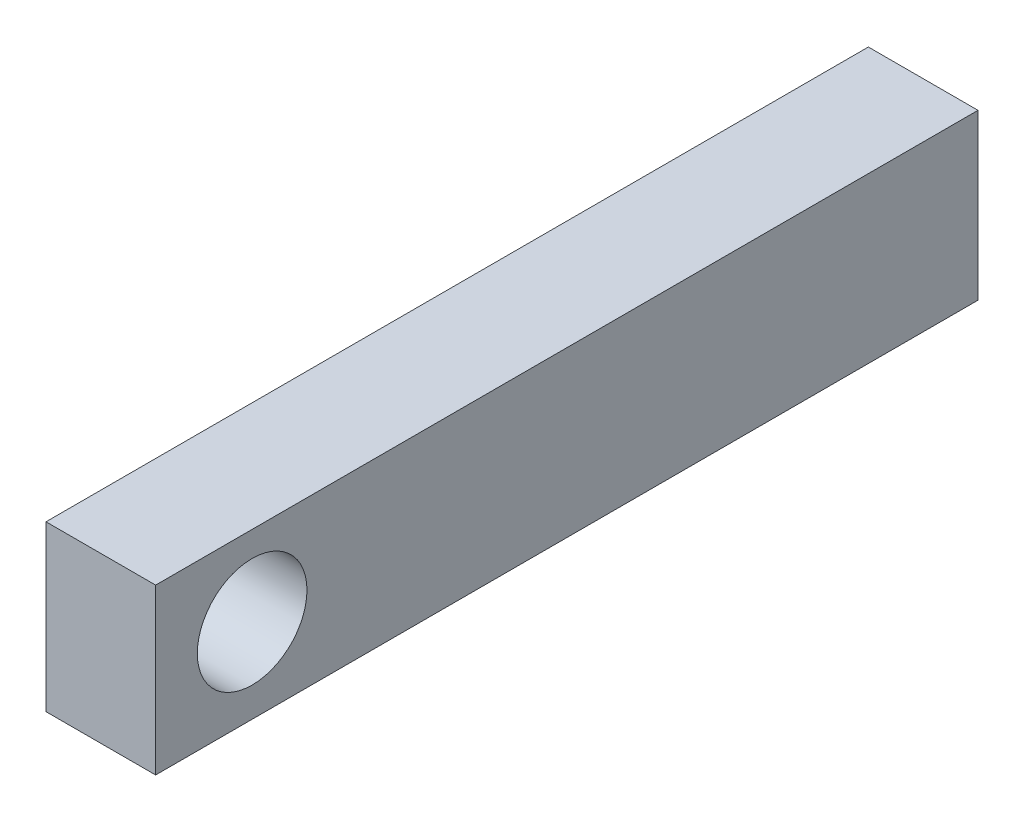
from build123d import *

# Parameters (mm, degrees)
SKETCH_1_W          = 2
SKETCH_1_H          = 15
EXTRUDE_2_DEPTH     = 3
SKETCH_2_R          = 1
CUT_EXTRUDE_1_DEPTH = 28.593457412


with BuildPart() as part:
    # 草图1 → 凸台-拉伸2 (new body)
    with BuildSketch(Plane(origin=(0, 0, 0), x_dir=(1, 0, 0), z_dir=(0, 1, 0))):
        with Locations((-25.105263158, 0.921052632)):
            Rectangle(SKETCH_1_W, SKETCH_1_H)
    extrude(amount=EXTRUDE_2_DEPTH)

    # 草图2 → 切除-拉伸1 (cut, through all)
    with BuildSketch(Plane(origin=(0, 0, 0), x_dir=(0, 0, -1), z_dir=(1, 0, 0))):
        with Locations((-4.818669328, 1.540779552)):
            Circle(SKETCH_2_R)
    extrude(amount=-CUT_EXTRUDE_1_DEPTH, mode=Mode.SUBTRACT)


solid = part.part
